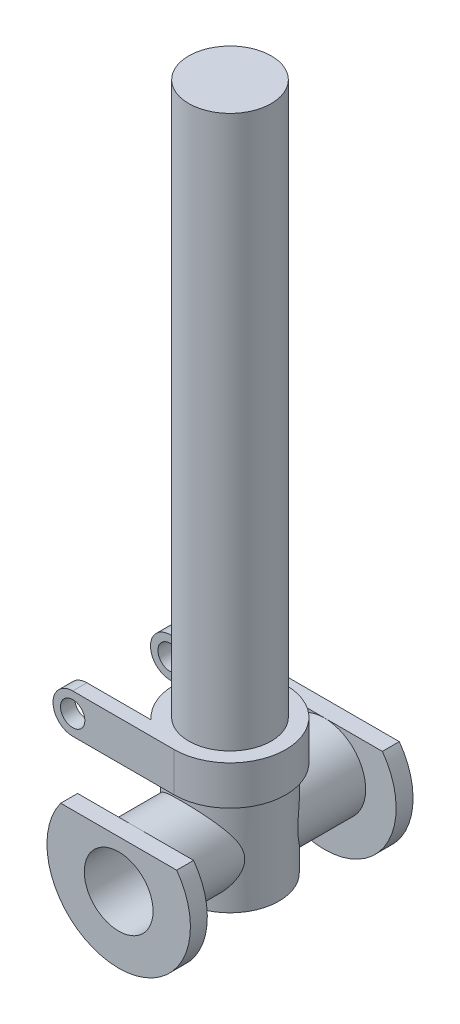
from build123d import *

# Parameters (mm, degrees)
SKETCH1_R                = 61
BOSS_EXTRUDE1_DEPTH      = 815.982336818
BOSS_EXTRUDE2_DEPTH      = 58
CUT_EXTRUDE1_DEPTH       = 493
CUT_EXTRUDE2_DEPTH       = 493
BOSS_EXTRUDE3_DEPTH      = 139.5
BOSS_EXTRUDE3_DEPTH_BACK = 139.5
SKETCH6_R                = 61
SKETCH7_R                = 106
BOSS_EXTRUDE5_DEPTH      = 25
CUT_EXTRUDE3_DEPTH       = 51
SKETCH9_R                = 72.5
BOSS_EXTRUDE6_DEPTH      = 141
SKETCH11_R               = 38.5
CUT_EXTRUDE6_DEPTH       = 450
SKETCH12_R               = 50.8
CUT_EXTRUDE7_DEPTH       = 630


with BuildPart() as part:
    # Sketch1 → Boss-Extrude1 (new body)
    with BuildSketch(Plane(origin=(0, 0, 0), x_dir=(1, 0, 0), z_dir=(0, 1, 0))):
        Circle(SKETCH1_R)
    extrude(amount=BOSS_EXTRUDE1_DEPTH)

    # Sketch2 → Boss-Extrude2 (add)
    with BuildSketch(Plane(origin=(0, 0, 0), x_dir=(-1, 0, 0), z_dir=(0, -1, 0))):
        with BuildLine():
            Line((0, 82.5), (179, 82.5))
            Line((179, 82.5), (179, 61.5))
            Line((179, 61.5), (54.990908339, 61.5))
            ThreePointArc((54.990908339, 61.5), (82.5, 0), (54.990908339, -61.5))
            Line((54.990908339, -61.5), (179, -61.5))
            Line((179, -61.5), (179, -82.5))
            Line((179, -82.5), (0, -82.5))
            ThreePointArc((0, -82.5), (-82.5, 0), (0, 82.5))
        make_face()
    extrude(amount=BOSS_EXTRUDE2_DEPTH)

    # Sketch3 → Cut-Extrude1 (cut)
    with BuildSketch(Plane(origin=(0, 0, -82.5), x_dir=(-1, 0, 0), z_dir=(0, 0, -1))):
        with BuildLine():
            Line((179, 0), (150, 0))
            ThreePointArc((150, 0), (170.506096654, -8.493903346), (179, -29))
            Line((179, -29), (179, 0))
        make_face()
        with BuildLine():
            ThreePointArc((179, -29), (170.506096654, -49.506096654), (150, -58))
            Line((150, -58), (179, -58))
            Line((179, -58), (179, -29))
        make_face()
    extrude(amount=-CUT_EXTRUDE1_DEPTH, mode=Mode.SUBTRACT)

    # Sketch3<3> → Cut-Extrude2 (cut)
    with BuildSketch(Plane(origin=(0, 0, -82.5), x_dir=(-1, 0, 0), z_dir=(0, 0, -1))):
        with BuildLine():
            ThreePointArc((168, -29), (150, -11), (132, -29))
            ThreePointArc((132, -29), (150, -47), (168, -29))
        make_face()
    extrude(amount=-CUT_EXTRUDE2_DEPTH, mode=Mode.SUBTRACT)



with BuildPart() as body_2:
    # Sketch6 → Boss-Extrude3 (new, two sides: drawn at the far end of the back side and taken through both)
    with BuildSketch(Plane.XY.offset(-BOSS_EXTRUDE3_DEPTH_BACK)):
        with Locations((0, -131.5)):
            Circle(SKETCH6_R)
    extrude(amount=BOSS_EXTRUDE3_DEPTH + BOSS_EXTRUDE3_DEPTH_BACK)

    # Sketch7 → Boss-Extrude5 (add)
    with BuildSketch(Plane(origin=(0, 0, -139.5), x_dir=(-1, 0, 0), z_dir=(0, 0, -1))):
        with Locations((0, -132.886327958)):
            Circle(SKETCH7_R)
    boss_extrude5 = extrude(amount=BOSS_EXTRUDE5_DEPTH)

    # Sketch8 → Cut-Extrude3 (cut)
    with BuildSketch(Plane.XY.offset(-139.5)):
        Polygon((0, -70.5), (144.590777868, -70.5), (144.590777868, 11.025223161), (-136.314365489, 11.025223161), (-136.314365489, -70.5), align=None)
    cut_extrude3 = extrude(amount=-CUT_EXTRUDE3_DEPTH, mode=Mode.SUBTRACT)

    # Mirror1: Boss-Extrude5, Cut-Extrude3 across plane
    add(boss_extrude5.mirror(Plane.XY))
    add(cut_extrude3.mirror(Plane.XY), mode=Mode.SUBTRACT)


with BuildPart() as part_1:
    add(part.part)

    add(body_2.part)  # Boss-Extrude6 merges body 2
    # Sketch9 → Boss-Extrude6 (add)
    with BuildSketch(Plane.XZ.offset(58)):
        Circle(SKETCH9_R)
    extrude(amount=BOSS_EXTRUDE6_DEPTH)

    # Sketch11 → Cut-Extrude6 (cut)
    with BuildSketch(Plane(origin=(0, 0, -164.5), x_dir=(-1, 0, 0), z_dir=(0, 0, -1))):
        with Locations((0, -141.739564151)):
            Circle(SKETCH11_R)
    extrude(amount=-CUT_EXTRUDE6_DEPTH, mode=Mode.SUBTRACT)

    # Sketch12 → Cut-Extrude7 (cut)
    with BuildSketch(Plane(origin=(0, 0, -164.5), x_dir=(-1, 0, 0), z_dir=(0, 0, -1))):
        with Locations((0, -140.586472034)):
            Circle(SKETCH12_R)
    extrude(amount=-CUT_EXTRUDE7_DEPTH, mode=Mode.SUBTRACT)


solid = part_1.part
